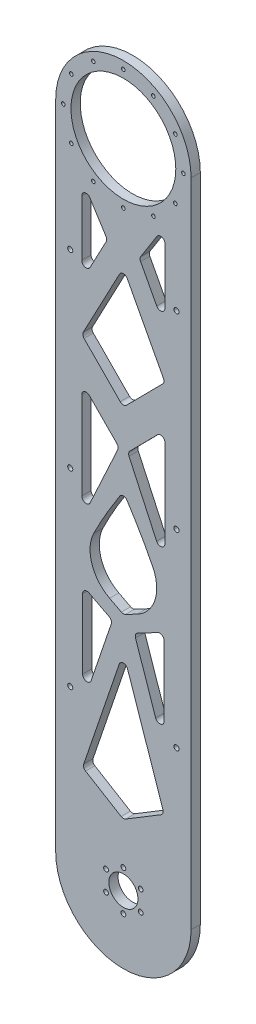
from build123d import *

# Parameters (mm, degrees)
SKETCH2_R                            = 10
SKETCH2_R_2                          = 1.65
BOSS_EXTRUDE1_DEPTH                  = 6.35
CUT_EXTRUDE1_DEPTH                   = 10
FILLET3_R                            = 3
SKETCH5_R                            = 1.75
CUT_EXTRUDE2_DEPTH                   = 549.511460792
SKETCH6_R                            = 26.5
CUT_EXTRUDE3_DEPTH                   = 10
BOSS_EXTRUDE2_START                  = -6.35
BOSS_EXTRUDE2_DEPTH                  = 6.35
TAP_DRILL_FOR_M3X0_5_TAP1_AT_2_COUNT = 2
TAP_DRILL_FOR_M3X0_5_TAP1_AT_2_PITCH = 12
CIRPATTERN2_COUNT                    = 2
CIRPATTERN2_ANGLE                    = 90
CUT_EXTRUDE4_DEPTH                   = 549.511460792
SKETCH11_R                           = 36
CUT_EXTRUDE5_DEPTH                   = 549.511460792
CUT_EXTRUDE6_DEPTH                   = 549.511460792
CUT_EXTRUDE6_DEPTH_BACK              = 549.511460792
SKETCH12_R                           = 1.25
SKETCH13_W                           = 93
SKETCH13_H                           = 53.952458561
CUT_EXTRUDE7_DEPTH                   = 549.511460792
BOSS_EXTRUDE3_REACH                  = 319.131
SKETCH14_W                           = 17.515975695
SKETCH14_H                           = 6.35
BOSS_EXTRUDE4_DEPTH                  = 6.35
SKETCH16_R                           = 1.75
CUT_EXTRUDE8_DEPTH                   = 497.007604239
SKETCH17_R                           = 1.75
BOSS_EXTRUDE5_DEPTH                  = 6.35


with BuildPart() as part:
    # Sketch2 → Boss-Extrude1 (new body)
    with BuildSketch(Plane.XY):
        with BuildLine():
            Line((-46.5, 0), (-46.5, 500))
            ThreePointArc((-46.5, 500), (0, 546.5), (46.5, 500))
            Line((46.5, 500), (46.5, 0))
            ThreePointArc((46.5, 0), (0, -46.5), (-46.5, 0))
        make_face()
        Circle(SKETCH2_R, mode=Mode.SUBTRACT)
        with Locations((0, 13.75)):
            Circle(SKETCH2_R_2, mode=Mode.SUBTRACT)
        with Locations((11.907849302, 6.875)):
            Circle(SKETCH2_R_2, mode=Mode.SUBTRACT)
        with Locations((11.907849302, -6.875)):
            Circle(SKETCH2_R_2, mode=Mode.SUBTRACT)
        with Locations((0, -13.75)):
            Circle(SKETCH2_R_2, mode=Mode.SUBTRACT)
        with Locations((-11.907849302, -6.875)):
            Circle(SKETCH2_R_2, mode=Mode.SUBTRACT)
        with Locations((-11.907849302, 6.875)):
            Circle(SKETCH2_R_2, mode=Mode.SUBTRACT)
    extrude(amount=BOSS_EXTRUDE1_DEPTH)

    # Sketch4 → Cut-Extrude1 (cut)
    with BuildSketch(Plane.XY.offset(6.35)):
        Polygon((28.005258112, 59.37595418), (0, 42.411661153), (-28.005258112, 59.37595418), (0, 141.693437584), align=None)
        Polygon((-7.5, 156.905935087), (-28.005258112, 96.633637735), (-28.005258112, 167.582877854), align=None)
        Polygon((28.005258112, 167.582877854), (7.5, 156.905935087), (28.005258112, 96.633637735), align=None)
        with BuildLine():
            Line((0, 164.275138905), (28.550546746, 179.141206521))
            add(Edge.make_bspline(
                [(28.550546746, 179.141206521), (45.32025339, 216.985654627), (19.430092874, 259.790255689), (0, 290.025756679)],
                knots=[0, 0, 0, 0, 1, 1, 1, 1], degree=3))
            add(Edge.make_bspline(
                [(-28.550546746, 179.141206521), (-45.32025339, 216.985654627), (-19.430092874, 259.790255689), (0, 290.025756679)],
                knots=[0, 0, 0, 0, 1, 1, 1, 1], degree=3))
            Line((-28.550546746, 179.141206521), (0, 164.275138905))
        make_face()
        Polygon((28.550546746, 259.58677623), (3, 314.938284003), (28.550546746, 340.793051053), align=None)
        Polygon((-3, 314.938284003), (-28.550546746, 340.793051053), (-28.550546746, 259.58677623), align=None)
        Polygon((0, 423.142843498), (-28.550546746, 369.246205395), (0, 340.355718526), (28.550546746, 369.246205395), align=None)
        Polygon((-28.550546746, 462.095190817), (-28.550546746, 401.290241252), (-11, 434.421497018), align=None)
        Polygon((28.550546746, 401.290241252), (11, 434.421497018), (28.550546746, 462.095190817), align=None)
    extrude(amount=-CUT_EXTRUDE1_DEPTH, mode=Mode.SUBTRACT)

    # Fillet3
    fillet3_edges = [part.edges().sort_by_distance(p)[0] for p in [
        (-11, 434.421497018, 3.175),
        (-28.550546746, 401.290241252, 3.175),
        (28.550546746, 401.290241252, 3.175),
        (11, 434.421497018, 3.175),
        (28.550546746, 462.095190817, 3.175),
        (-28.550546746, 462.095190817, 3.175),
        (0, 423.142843498, 3.175),
        (-28.550546746, 369.246205395, 3.175),
        (28.550546746, 369.246205395, 3.175),
        (0, 340.355718526, 3.175),
        (28.550546746, 340.793051053, 3.175),
        (-28.550546746, 340.793051053, 3.175),
        (-3, 314.938284003, 3.175),
        (3, 314.938284003, 3.175),
        (28.550546746, 259.58677623, 3.175),
        (-28.550546746, 259.58677623, 3.175),
        (28.550546746, 179.141206521, 3.175),
        (0, 290.025756679, 3.175),
        (-28.550546746, 179.141206521, 3.175),
        (0, 164.275138905, 3.175),
        (-28.005258112, 96.633637735, 3.175),
        (28.005258112, 96.633637735, 3.175),
        (7.5, 156.905935087, 3.175),
        (-28.005258112, 167.582877854, 3.175),
        (28.005258112, 167.582877854, 3.175),
        (0, 141.693437584, 3.175),
        (28.005258112, 59.37595418, 3.175),
        (-28.005258112, 59.37595418, 3.175),
        (0, 42.411661153, 3.175),
        (-7.5, 156.905935087, 3.175),
    ]]
    fillet(fillet3_edges, radius=FILLET3_R)

    # Sketch5 → Cut-Extrude2 (cut, through all)
    with BuildSketch(Plane.XY.offset(6.35)):
        with Locations((36.5, 103.175)):
            Circle(SKETCH5_R)
        with Locations(Location((-36.5, 103.175, 0), (0, 0, 180))):
            Circle(SKETCH5_R)
        with Locations(Location((36.5, 259.525, 0), (0, 0, 180))):
            Circle(SKETCH5_R)
        with Locations((-36.5, 259.525)):
            Circle(SKETCH5_R)
        with Locations((36.5, 415.875)):
            Circle(SKETCH5_R)
        with Locations(Location((-36.5, 415.875, 0), (0, 0, 180))):
            Circle(SKETCH5_R)
    extrude(amount=-CUT_EXTRUDE2_DEPTH, mode=Mode.SUBTRACT)

    # Sketch6 → Cut-Extrude3 (cut)
    with BuildSketch(Plane.XY.offset(6.35)):
        with Locations((0, 500)):
            Circle(SKETCH6_R)
    extrude(amount=-CUT_EXTRUDE3_DEPTH, mode=Mode.SUBTRACT)

    # Sketch7 → Boss-Extrude2 (add)
    with BuildSketch(Plane.XY.offset(6.35).offset(BOSS_EXTRUDE2_START)):
        with BuildLine():
            Line((44.110383395, 529.968247771), (29.968247771, 544.110383395))
            ThreePointArc((29.968247771, 544.110383395), (23.286397782, 542.399293624), (16.474718596, 543.483717035))
            ThreePointArc((16.474718596, 543.483717035), (32.880465325, 532.880465325), (43.483717035, 516.474718596))
            ThreePointArc((43.483717035, 516.474718596), (42.399293624, 523.286397782), (44.110383395, 529.968247771))
        make_face()
    boss_extrude2 = extrude(amount=BOSS_EXTRUDE2_DEPTH)

    # Sketch9 → Tap Drill for M3x0.5 Tap1 (revolve, cut)
    with BuildSketch(Plane(origin=(32.796674896, 541.28195627, 3.175), x_dir=(-0.7071067811865481, 0.7071067811865469, 0), z_dir=(0, 0, 1))):
        Polygon((0, 0), (0, 5.751075774), (1.25, 5), (1.25, 0), align=None)
    tap_drill_for_m3x0_5_tap1 = revolve(axis=Axis((37.286802956, 545.772084331, 3.175), (-0.7071067811865468, -0.7071067811865482, 0)), mode=Mode.SUBTRACT)

    # Tap Drill for M3x0.5 Tap1 at 2: Tap Drill for M3x0.5 Tap1 ×2
    with Locations(*[Vector(0.7071067811865482, -0.7071067811865468, 0) * (i * TAP_DRILL_FOR_M3X0_5_TAP1_AT_2_PITCH) for i in range(1, TAP_DRILL_FOR_M3X0_5_TAP1_AT_2_COUNT)]):
        add(tap_drill_for_m3x0_5_tap1, mode=Mode.SUBTRACT)

    # CirPattern2: Boss-Extrude2, Tap Drill for M3x0.5 Tap1 ×2 about axis
    cirpattern2_axis = Axis((0, 500, 0), (0, 0, 1))
    add([boss_extrude2.rotate(cirpattern2_axis, i * CIRPATTERN2_ANGLE / (CIRPATTERN2_COUNT - 1)) for i in range(1, CIRPATTERN2_COUNT)])
    add([tap_drill_for_m3x0_5_tap1.rotate(cirpattern2_axis, i * CIRPATTERN2_ANGLE / (CIRPATTERN2_COUNT - 1)) for i in range(1, CIRPATTERN2_COUNT)], mode=Mode.SUBTRACT)

    # CirPattern2 copy 1 sketch → CirPattern2 copy 1 (revolve, cut)
    with BuildSketch(Plane(origin=(-32.796674896, 541.28195627, 3.175), x_dir=(-0.7071067811865445, -0.7071067811865506, 0), z_dir=(0, 0, 1))):
        Polygon((0, 0), (0, 5.751075774), (1.25, 5), (1.25, 0), align=None)
    revolve(axis=Axis((-37.286802956, 545.772084331, 3.175), (0.7071067811865507, -0.7071067811865444, 0)), mode=Mode.SUBTRACT)

    # Sketch10 → Cut-Extrude4 (cut, through all)
    with BuildSketch(Plane.XY.offset(6.35)):
        with BuildLine():
            Line((-43.483717035, 516.474718596), (-63.483717035, 516.474718596))
            ThreePointArc((-63.483717035, 516.474718596), (0, 565.586573942), (63.483717035, 516.474718596))
            Line((63.483717035, 516.474718596), (43.483717035, 516.474718596))
            ThreePointArc((43.483717035, 516.474718596), (0, 546.5), (-43.483717035, 516.474718596))
        make_face()
    extrude(amount=-CUT_EXTRUDE4_DEPTH, mode=Mode.SUBTRACT)

    # Sketch11 → Cut-Extrude5 (cut, through all)
    with BuildSketch(Plane.XY.offset(6.35)):
        with Locations((0, 500)):
            Circle(SKETCH11_R)
    extrude(amount=-CUT_EXTRUDE5_DEPTH, mode=Mode.SUBTRACT)

    # Sketch12 → Cut-Extrude6 (cut, two sides: drawn at the far end of the back side and taken through both)
    with BuildSketch(Plane.XY.offset(6.35).offset(-CUT_EXTRUDE6_DEPTH_BACK)):
        with Locations((0, 541.25)):
            Circle(SKETCH12_R)
        with Locations((20.625, 535.723547906)):
            Circle(SKETCH12_R)
        with Locations((35.723547906, 520.625)):
            Circle(SKETCH12_R)
        with Locations((41.25, 500)):
            Circle(SKETCH12_R)
        with Locations((35.723547906, 479.375)):
            Circle(SKETCH12_R)
        with Locations((20.625, 464.276452094)):
            Circle(SKETCH12_R)
        with Locations((0, 458.75)):
            Circle(SKETCH12_R)
        with Locations((-20.625, 464.276452094)):
            Circle(SKETCH12_R)
        with Locations((-35.723547906, 479.375)):
            Circle(SKETCH12_R)
        with Locations((-41.25, 500)):
            Circle(SKETCH12_R)
        with Locations((-35.723547906, 520.625)):
            Circle(SKETCH12_R)
        with Locations((-20.625, 535.723547906)):
            Circle(SKETCH12_R)
    extrude(amount=CUT_EXTRUDE6_DEPTH + CUT_EXTRUDE6_DEPTH_BACK, mode=Mode.SUBTRACT)

    # Sketch13 → Cut-Extrude7 (cut, through all)
    with BuildSketch(Plane(origin=(0, 0, 0), x_dir=(-1, 0, 0), z_dir=(0, 0, -1))):
        with Locations((0, 207.119171895)):
            Rectangle(SKETCH13_W, SKETCH13_H)
    extrude(amount=-CUT_EXTRUDE7_DEPTH, mode=Mode.SUBTRACT)


with BuildPart() as cut_extrude7_piece_1:
    # of the separate pieces the step leaves, piece 1, a body of its own (cut_extrude7_pieces)
    add(part.part.solids().sort_by_distance((46.5, 500, 0))[0])


with BuildPart() as cut_extrude7_piece_2:
    # of the separate pieces the step leaves, piece 2, a body of its own (cut_extrude7_pieces)
    add(part.part.solids().sort_by_distance((46.5, 180.142942614, 0))[0])


with BuildPart() as cut_extrude7_piece_1_1:
    # Body-Move/Copy1: moved
    add(cut_extrude7_piece_1.part.moved(Location((0, -52.7176888, 0))))

    # Boss-Extrude3: up to this face of the body (flat: up to its plane)
    boss_extrude3_end = Plane(cut_extrude7_piece_1_1.part.faces().sort_by_distance((37.742012152, 181.377712375, 3.175))[0])
    # Sketch14 → Boss-Extrude3 (add, up to the picked face)
    with BuildSketch(Plane(origin=(0, 180.142942614, 0), x_dir=(1, 0, 0), z_dir=(0, 1, 0)), mode=Mode.PRIVATE) as boss_extrude3_sk1:
        with Locations((-37.742012153, -3.175)):
            Rectangle(SKETCH14_W, SKETCH14_H)
    boss_extrude3_tool1 = split(extrude(boss_extrude3_sk1.sketch, amount=BOSS_EXTRUDE3_REACH, mode=Mode.PRIVATE), bisect_by=boss_extrude3_end, keep=Keep.BOTH, mode=Mode.PRIVATE)
    # Sketch14 → Boss-Extrude3 (add, up to the picked face)
    with BuildSketch(Plane(origin=(0, 180.142942614, 0), x_dir=(1, 0, 0), z_dir=(0, 1, 0)), mode=Mode.PRIVATE) as boss_extrude3_sk2:
        with Locations((37.742012153, -3.175)):
            Rectangle(SKETCH14_W, SKETCH14_H)
    boss_extrude3_tool2 = split(extrude(boss_extrude3_sk2.sketch, amount=BOSS_EXTRUDE3_REACH, mode=Mode.PRIVATE), bisect_by=boss_extrude3_end, keep=Keep.BOTH, mode=Mode.PRIVATE)

    add(cut_extrude7_piece_2.part)  # Boss-Extrude3 merges Cut-Extrude7 piece 2
    add(boss_extrude3_tool1.solids().sort_by(Axis((-37.742012, 180.142943, 3.175), (0, 1, 0)))[0])
    add(boss_extrude3_tool2.solids().sort_by(Axis((37.742012, 180.142943, 3.175), (0, 1, 0)))[0])

    # Sketch15 → Boss-Extrude4 (add)
    with BuildSketch(Plane(origin=(0, 0, 0), x_dir=(-1, 0, 0), z_dir=(0, 0, -1))):
        with BuildLine():
            Line((28.984024305, 181.377712375), (28.984024305, 180.142942614))
            ThreePointArc((28.984024305, 180.142942614), (28.425309599, 179.275911344), (27.605954054, 178.649363792))
            Line((27.605954054, 178.649363792), (9.43812576, 169.189504186))
            ThreePointArc((9.43812576, 169.189504186), (21.644913421, 183.565600372), (20.334408511, 202.379435266))
            add(Edge.make_bspline(
                [(28.984024305, 181.377712375), (26.665870811, 188.528361062), (23.678798122, 195.56600215), (20.334408511, 202.379435266)],
                knots=[0.471090389, 0.471090389, 0.471090389, 0.471090389, 0.656207947, 0.656207947, 0.656207947, 0.656207947], degree=3))
        make_face()
        with BuildLine():
            Line((-9.43812576, 169.189504186), (-27.605954054, 178.649363792))
            ThreePointArc((-27.605954054, 178.649363792), (-28.425309599, 179.275911344), (-28.984024305, 180.142942614))
            Line((-28.984024305, 180.142942614), (-28.984024304, 181.377712375))
            add(Edge.make_bspline(
                [(-28.984024304, 181.377712375), (-26.665870811, 188.528361062), (-23.678798122, 195.56600215), (-20.334408511, 202.379435266)],
                knots=[0.471090389, 0.471090389, 0.471090389, 0.471090389, 0.656207947, 0.656207947, 0.656207947, 0.656207947], degree=3))
            ThreePointArc((-20.334408511, 202.379435266), (-21.644913421, 183.565600372), (-9.43812576, 169.189504186))
        make_face()
    extrude(amount=-BOSS_EXTRUDE4_DEPTH)

    # Sketch16 → Cut-Extrude8 (cut, through all)
    with BuildSketch(Plane(origin=(0, 0, 0), x_dir=(-1, 0, 0), z_dir=(0, 0, -1))):
        with Locations((36.5, 233.1661556)):
            Circle(SKETCH16_R)
        with Locations((-36.5, 233.1661556)):
            Circle(SKETCH16_R)
    extrude(amount=-CUT_EXTRUDE8_DEPTH, mode=Mode.SUBTRACT)

    # Sketch17 → Boss-Extrude5 (add)
    with BuildSketch(Plane(origin=(0, 0, 0), x_dir=(-1, 0, 0), z_dir=(0, 0, -1))):
        with Locations((36.5, 206.8073112)):
            Circle(SKETCH17_R)
        with Locations((-36.5, 206.8073112)):
            Circle(SKETCH17_R)
    extrude(amount=-BOSS_EXTRUDE5_DEPTH)


solid = cut_extrude7_piece_1_1.part
